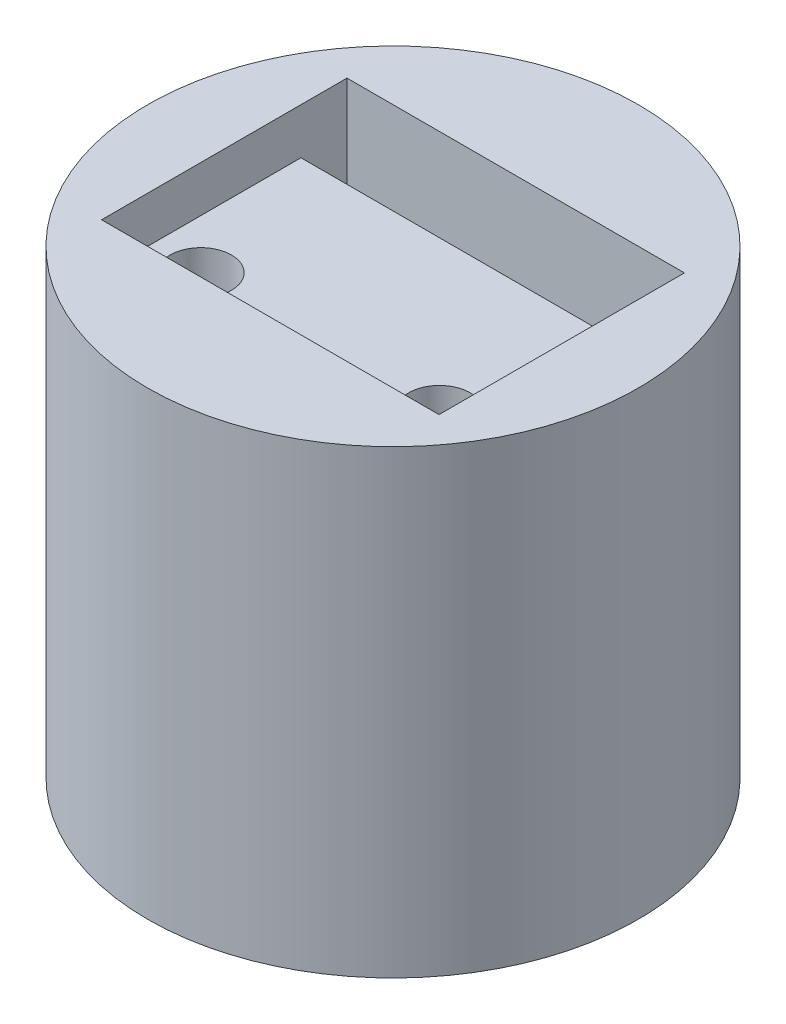
from build123d import *

# Parameters (mm, degrees)
SKETCH1_R           = 16
BOSS_EXTRUDE1_DEPTH = 30
SKETCH2_W           = 22
SKETCH2_H           = 16
CUT_EXTRUDE1_DEPTH  = 3
SKETCH3_R           = 2
CUT_EXTRUDE2_DEPTH  = 6.7
SKETCH4_W           = 22
SKETCH4_H           = 3
CUT_EXTRUDE3_DEPTH  = 8.76


with BuildPart() as part:
    # Sketch1 → Boss-Extrude1 (new body)
    with BuildSketch(Plane(origin=(0, 0, 0), x_dir=(1, 0, 0), z_dir=(0, 1, 0))):
        with Locations(Location((0, 0, 0), (0, 0, 270))):
            Circle(SKETCH1_R)
    extrude(amount=BOSS_EXTRUDE1_DEPTH)

    # Sketch2 → Cut-Extrude1 (cut)
    with BuildSketch(Plane(origin=(0, 30, 0), x_dir=(1, 0, 0), z_dir=(0, 1, 0))):
        Rectangle(SKETCH2_W, SKETCH2_H)
    extrude(amount=-CUT_EXTRUDE1_DEPTH, mode=Mode.SUBTRACT)

    # Sketch3 → Cut-Extrude2 (cut)
    with BuildSketch(Plane(origin=(0, 27, 0), x_dir=(1, 0, 0), z_dir=(0, 1, 0))):
        with Locations(Location((-7.78, -4.752687539, 0), (0, 0, 270))):
            Circle(SKETCH3_R)
        with Locations(Location((7.78, -4.752687539, 0), (0, 0, 270))):
            Circle(SKETCH3_R)
    extrude(amount=-CUT_EXTRUDE2_DEPTH, mode=Mode.SUBTRACT)

    # Sketch4 → Cut-Extrude3 (cut)
    with BuildSketch(Plane(origin=(0, 27, 0), x_dir=(1, 0, 0), z_dir=(0, 1, 0))):
        with Locations((0, 6.5)):
            Rectangle(SKETCH4_W, SKETCH4_H)
    extrude(amount=-CUT_EXTRUDE3_DEPTH, mode=Mode.SUBTRACT)


solid = part.part
